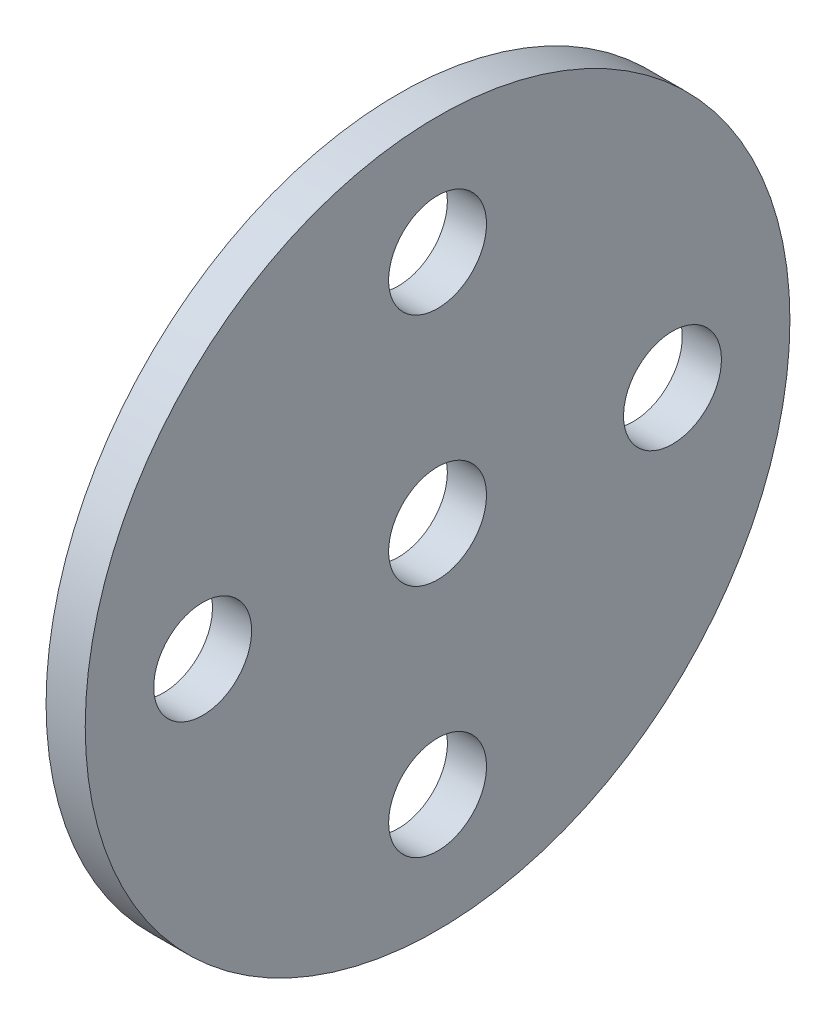
from build123d import *

# Parameters (mm, degrees)
SKETCH1_R           = 28.575
SKETCH1_R_2         = 3.96875
BOSS_EXTRUDE1_DEPTH = 3.175
SKETCH2_R           = 3.96875
CUT_EXTRUDE1_DEPTH  = 41.535686438
CIRPATTERN1_COUNT   = 4


with BuildPart() as part:
    # Sketch1 → Boss-Extrude1 (new body)
    with BuildSketch(Plane(origin=(0, 0, 0), x_dir=(0, 0, -1), z_dir=(1, 0, 0))):
        Circle(SKETCH1_R)
        Circle(SKETCH1_R_2, mode=Mode.SUBTRACT)
    extrude(amount=BOSS_EXTRUDE1_DEPTH)

    # Sketch2 → Cut-Extrude1 (cut, through all)
    with BuildSketch(Plane(origin=(0, 0, 0), x_dir=(0, 0, -1), z_dir=(1, 0, 0))):
        with Locations((0, 19.05)):
            Circle(SKETCH2_R)
    cut_extrude1 = extrude(amount=CUT_EXTRUDE1_DEPTH, mode=Mode.SUBTRACT)

    # CirPattern1: Cut-Extrude1 ×4 about axis
    cirpattern1_axis = Axis((0, 0, 0), (1, 0, 0))
    for i in range(1, CIRPATTERN1_COUNT):
        add(cut_extrude1.rotate(cirpattern1_axis, i * 360 / CIRPATTERN1_COUNT), mode=Mode.SUBTRACT)


solid = part.part
